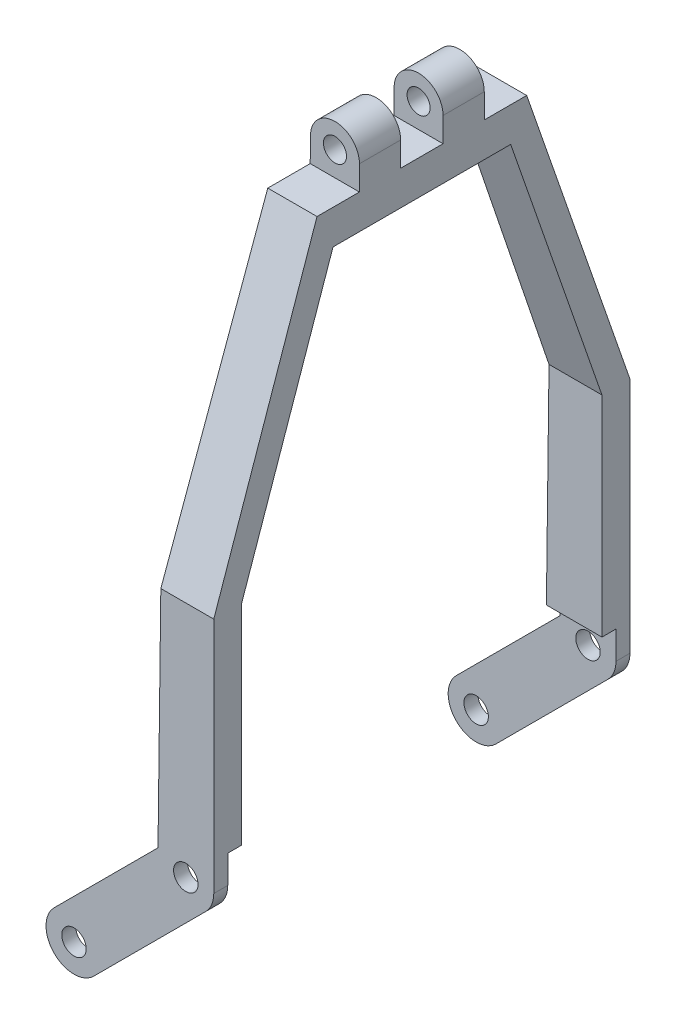
from build123d import *

# Parameters (mm, degrees)
CROQUIS1_R              = 1.75
CROQUIS1_R_2            = 1.65
SALIENTE_EXTRUIR1_DEPTH = 59.54
CROQUIS2_W              = 3.035
CROQUIS2_H              = 7
CROQUIS2_W_2            = 6.07
CORTAR_EXTRUIR1_DEPTH   = 106.323314904


with BuildPart() as part:
    # Croquis1 → Saliente-Extruir1 (new body)
    with BuildSketch(Plane.XY):
        with BuildLine():
            Line((-13.171572875, -18.828427125), (2.828427125, -2.828427125))
            ThreePointArc((2.828427125, -2.828427125), (3.69551813, -1.530733729), (4, 0))
            Line((4, 0), (4, 79.998437485))
            ThreePointArc((4, 79.998437485), (0.521875, 83.498369125), (-2.999726562, 80.04218663))
            Line((-2.999726562, 80.04218663), (-3.979342398, 1.677511852))
            Line((-3.979342398, 1.677511852), (-18.828427125, -13.171572875))
            ThreePointArc((-18.828427125, -13.171572875), (-18.828427125, -18.828427125), (-13.171572875, -18.828427125))
        make_face()
        Circle(CROQUIS1_R, mode=Mode.SUBTRACT)
        with Locations((-16, -16)):
            Circle(CROQUIS1_R, mode=Mode.SUBTRACT)
        with Locations((0.5, 79.998437485)):
            Circle(CROQUIS1_R_2, mode=Mode.SUBTRACT)
    extrude(amount=-SALIENTE_EXTRUIR1_DEPTH)

    # Croquis2 → Cortar-Extruir1 (cut, through all)
    with BuildSketch(Plane(origin=(4, 0, 0), x_dir=(0, 0, -1), z_dir=(1, 0, 0))):
        Polygon((2, 4), (2, -20), (57.54, -20), (57.54, 4), (55.54, 4), (4, 4), align=None)
        with Locations((28.2525, 79.998437485)):
            Rectangle(CROQUIS2_W, CROQUIS2_H)
        with Locations((31.2875, 79.998437485)):
            Rectangle(CROQUIS2_W, CROQUIS2_H)
        Polygon((4, 34), (4, 4), (55.54, 4), (55.54, 34), (29.77, 34), align=None)
        Polygon((17.060486247, 71.579570635), (4, 34), (29.77, 34), (29.77, 71.579570635), align=None)
        Polygon((29.77, 34), (55.54, 34), (42.479513753, 71.579570635), (29.77, 71.579570635), align=None)
        Polygon((14.77, 76.498437485), (14.77, 83.498437485), (0, 83.498437485), (0, 34), align=None)
        with Locations((17.805, 79.998437485)):
            Rectangle(CROQUIS2_W_2, CROQUIS2_H)
        Polygon((44.77, 76.498437485), (59.54, 34), (59.54, 83.498437485), (44.77, 83.498437485), align=None)
        with Locations((41.735, 79.998437485)):
            Rectangle(CROQUIS2_W_2, CROQUIS2_H)
    extrude(amount=-CORTAR_EXTRUIR1_DEPTH, mode=Mode.SUBTRACT)


solid = part.part
